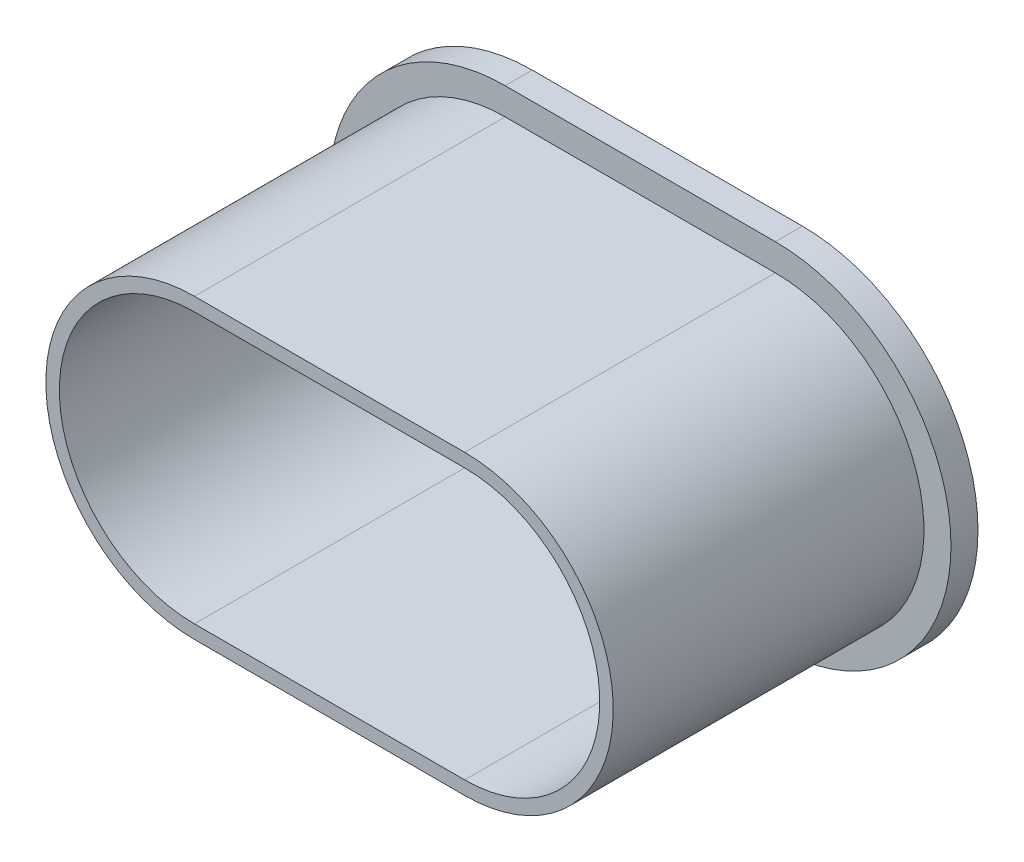
from build123d import *

# Parameters (mm, degrees)
EXTRUDE_1_DEPTH     = 2
EXTRUDE_2_DEPTH     = 23
SKETCH_4_R          = 0.3
CUT_EXTRUDE_2_DEPTH = 0.5


with BuildPart() as part:
    # 草图1 → 凸台-拉伸1 (new body)
    with BuildSketch(Plane.XY):
        with BuildLine():
            Line((-7.168044136, -16.461643491), (-27.168044136, -16.461643491))
            ThreePointArc((-27.168044136, -16.461643491), (-40.168044136, -3.461643491), (-27.168044136, 9.538356509))
            Line((-27.168044136, 9.538356509), (-7.168044136, 9.538356509))
            ThreePointArc((-7.168044136, 9.538356509), (5.831955864, -3.461643491), (-7.168044136, -16.461643491))
        make_face()
        with BuildLine():
            Line((-27.168044136, -13.461643491), (-7.168044136, -13.461643491))
            ThreePointArc((-7.168044136, -13.461643491), (2.831955864, -3.461643491), (-7.168044136, 6.538356509))
            Line((-7.168044136, 6.538356509), (-27.168044136, 6.538356509))
            ThreePointArc((-27.168044136, 6.538356509), (-37.168044136, -3.461643491), (-27.168044136, -13.461643491))
        make_face(mode=Mode.SUBTRACT)
    extrude(amount=EXTRUDE_1_DEPTH)

    # 草图2 → 凸台-拉伸2 (add)
    with BuildSketch(Plane.XY.offset(2)):
        with BuildLine():
            Line((-27.168044136, 7.538356509), (-7.168044136, 7.538356509))
            ThreePointArc((-7.168044136, 7.538356509), (3.831955864, -3.461643491), (-7.168044136, -14.461643491))
            Line((-7.168044136, -14.461643491), (-27.168044136, -14.461643491))
            ThreePointArc((-27.168044136, -14.461643491), (-38.168044136, -3.461643491), (-27.168044136, 7.538356509))
        make_face()
        with BuildLine():
            Line((-27.168044136, 6.538356509), (-7.168044136, 6.538356509))
            ThreePointArc((-7.168044136, 6.538356509), (2.831955864, -3.461643491), (-7.168044136, -13.461643491))
            Line((-7.168044136, -13.461643491), (-27.168044136, -13.461643491))
            ThreePointArc((-27.168044136, -13.461643491), (-37.168044136, -3.461643491), (-27.168044136, 6.538356509))
        make_face(mode=Mode.SUBTRACT)
    extrude(amount=EXTRUDE_2_DEPTH)

    # 草图4 → 切除-拉伸2 (cut)
    with BuildSketch(Plane(origin=(0, 0, 0), x_dir=(-1, 0, 0), z_dir=(0, 0, -1))):
        with Locations((17.168044136, -14.461643491)):
            Circle(SKETCH_4_R)
    extrude(amount=-CUT_EXTRUDE_2_DEPTH, mode=Mode.SUBTRACT)


solid = part.part
